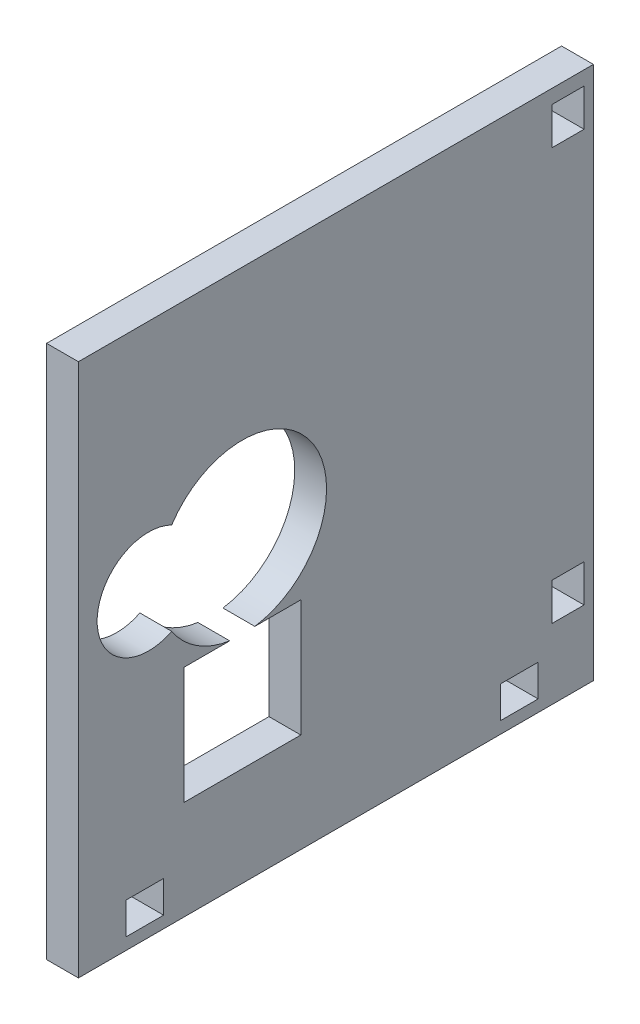
from build123d import *

# Parameters (mm, degrees)
SKETCH1_W           = 27.94
SKETCH1_H           = 28.956
SKETCH1_W_2         = 6.35
SKETCH1_H_2         = 6.35
SKETCH1_W_3         = 1.7272
SKETCH1_H_3         = 2.032
BOSS_EXTRUDE1_DEPTH = 1.7272
SKETCH3_W           = 2.032
SKETCH3_H           = 1.7272
CUT_EXTRUDE1_DEPTH  = 1.7272
SKETCH4_R           = 4.572
SKETCH4_R_2         = 2.794
CUT_EXTRUDE4_DEPTH  = 1.7272


with BuildPart() as part:
    # Sketch1 → Boss-Extrude1 (new body)
    with BuildSketch(Plane(origin=(0, 0, 0), x_dir=(0, 0, -1), z_dir=(1, 0, 0))):
        with Locations((13.97, 14.478)):
            Rectangle(SKETCH1_W, SKETCH1_H)
        with Locations((8.89, 8.5598)):
            Rectangle(SKETCH1_W_2, SKETCH1_H_2, mode=Mode.SUBTRACT)
        with Locations((26.5684, 4.826)):
            Rectangle(SKETCH1_W_3, SKETCH1_H_3, mode=Mode.SUBTRACT)
        with Locations((26.5684, 27.178)):
            Rectangle(SKETCH1_W_3, SKETCH1_H_3, mode=Mode.SUBTRACT)
    extrude(amount=BOSS_EXTRUDE1_DEPTH)

    # Sketch3 → Cut-Extrude1 (cut)
    with BuildSketch(Plane(origin=(1.7272, 0, 0), x_dir=(0, 0, -1), z_dir=(1, 0, 0))):
        with Locations((3.6068, 1.50495)):
            Rectangle(SKETCH3_W, SKETCH3_H)
        with Locations((23.9268, 1.50495)):
            Rectangle(SKETCH3_W, SKETCH3_H)
    extrude(amount=-CUT_EXTRUDE1_DEPTH, mode=Mode.SUBTRACT)

    # Sketch4 → Cut-Extrude4 (cut)
    with BuildSketch(Plane(origin=(1.7272, 0, 0), x_dir=(0, 0, -1), z_dir=(1, 0, 0))):
        with BuildLine():
            ThreePointArc((9.569657679, 11.7348), (12.354864998, 13.273066118), (13.462, 16.256))
            ThreePointArc((13.462, 16.256), (10.193220511, 20.638328183), (5.06095, 18.754311449))
            ThreePointArc((5.06095, 18.754311449), (6.18714012, 17.724210084), (6.604, 16.256))
            ThreePointArc((6.604, 16.256), (6.18714012, 14.787789916), (5.06095, 13.757688551))
            ThreePointArc((5.06095, 13.757688551), (6.41914372, 12.409176213), (8.210342321, 11.7348))
            Line((8.210342321, 11.7348), (9.569657679, 11.7348))
        make_face()
        with Locations((8.89, 16.256)):
            Circle(SKETCH4_R)
        with Locations((3.81, 16.256)):
            Circle(SKETCH4_R_2)
    extrude(amount=-CUT_EXTRUDE4_DEPTH, mode=Mode.SUBTRACT)


solid = part.part
